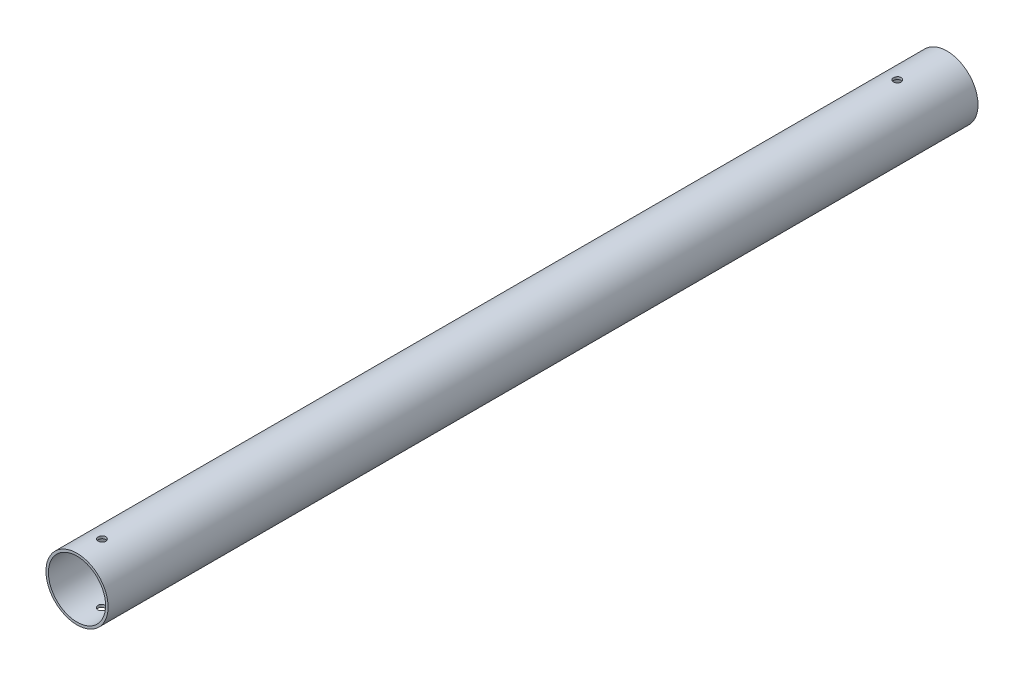
from build123d import *

# Parameters (mm, degrees)
SKETCH1_R           = 12.5
SKETCH1_R_2         = 11.5
BOSS_EXTRUDE1_DEPTH = 175
SKETCH2_R           = 1.55
CUT_EXTRUDE1_DEPTH  = 12.5
SKETCH3_R           = 1.55
CUT_EXTRUDE2_DEPTH  = 12.5


with BuildPart() as part:
    # Sketch1 → Boss-Extrude1 (new, symmetric)
    with BuildSketch(Plane.XY):
        Circle(SKETCH1_R)
        Circle(SKETCH1_R_2, mode=Mode.SUBTRACT)
    extrude(amount=BOSS_EXTRUDE1_DEPTH, both=True)

    # Sketch2 → Cut-Extrude1 (cut, symmetric)
    with BuildSketch(Plane(origin=(0, 0, 0), x_dir=(1, 0, 0), z_dir=(0, 1, 0))):
        with Locations(Location((0, 155, 0), (0, 0, 270))):
            Circle(SKETCH2_R)
    extrude(amount=CUT_EXTRUDE1_DEPTH, both=True, mode=Mode.SUBTRACT)

    # Sketch3 → Cut-Extrude2 (cut, symmetric)
    with BuildSketch(Plane(origin=(0, 0, 0), x_dir=(1, 0, 0), z_dir=(0, 1, 0))):
        with Locations(Location((0, -165, 0), (0, 0, 270))):
            Circle(SKETCH3_R)
    extrude(amount=CUT_EXTRUDE2_DEPTH, both=True, mode=Mode.SUBTRACT)


solid = part.part
